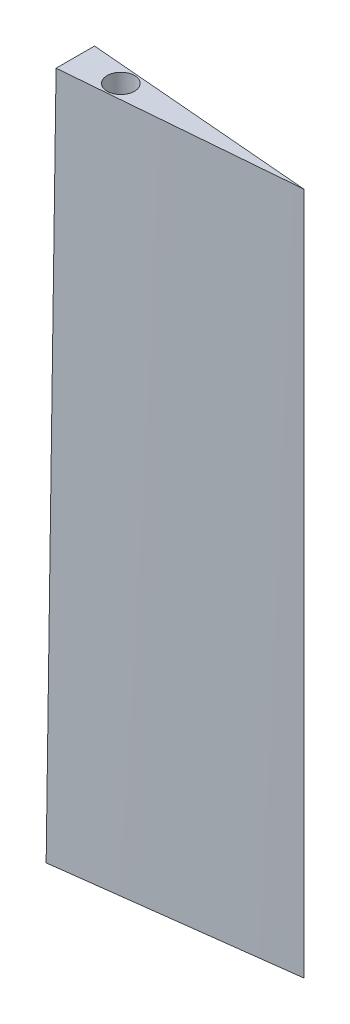
from build123d import *

# Parameters (mm, degrees)
SKETCH_3_R          = 1.5
CUT_EXTRUDE_1_DEPTH = 80.150161849


with BuildPart() as part:
    # Эскиз1 → По сечениям1 section 0
    with BuildSketch(Plane(origin=(0, 0, 0), x_dir=(1, 0, 0), z_dir=(0, 1, 0))):
        with BuildLine():
            Line((0, 3.2), (0, -3.2))
            Line((0, -3.2), (25.09, 0))
            Line((25.09, 0), (0, 3.2))
        make_face()
    # Эскиз2 → По сечениям1 section 1
    with BuildSketch(Plane(origin=(0, 75, 0), x_dir=(1, 0, 0), z_dir=(0, 1, 0))):
        with BuildLine():
            Line((0, 2.11), (0, -2.11))
            Line((0, -2.11), (25.09, 0))
            Line((25.09, 0), (0, 2.11))
        make_face()
    loft()

    # Эскиз3 → Вырез-Вытянуть1 (cut, through all)
    with BuildSketch(Plane.XZ):
        with Locations(Location((5, 0, 0), (0, 0, 270))):
            Circle(SKETCH_3_R)
    extrude(amount=-CUT_EXTRUDE_1_DEPTH, mode=Mode.SUBTRACT)


solid = part.part
